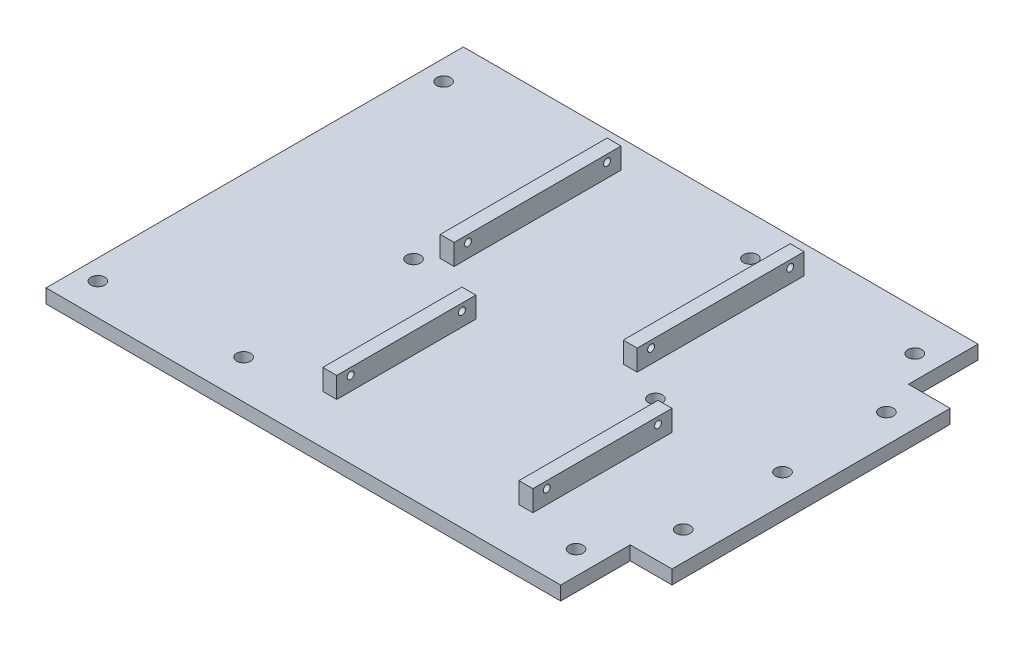
from build123d import *

# Parameters (mm, degrees)
SKETCH1_W               = 508
SKETCH1_H               = 381
BOSS_EXTRUDE1_DEPTH     = 12.7
SKETCH5_W               = 12.7
SKETCH5_H               = 127
BOSS_EXTRUDE2_DEPTH     = 19.05
SKETCH6_W               = 12.7
SKETCH6_H               = 127
BOSS_EXTRUDE3_DEPTH     = 19.05
SKETCH7_W               = 12.7
SKETCH7_H               = 152.4
BOSS_EXTRUDE6_DEPTH     = 19.05
CUT_EXTRUDE1_DEPTH      = 445.227773783
CUT_EXTRUDE1_DEPTH_BACK = 445.227773783
SKETCH8_R               = 3.175
CUT_EXTRUDE2_DEPTH      = 389.026049383
CUT_EXTRUDE2_DEPTH_BACK = 389.026049383
SKETCH9_R               = 3.175
SKETCH10_W              = 38.1
SKETCH10_H              = 63.5
CUT_EXTRUDE3_DEPTH      = 319.070986574
SKETCH11_W              = 38.1
SKETCH11_H              = 63.5
CUT_EXTRUDE4_DEPTH      = 319.070986574
CUT_EXTRUDE5_DEPTH      = 319.070986574
CUT_EXTRUDE5_DEPTH_BACK = 319.070986574
SKETCH13_R              = 6.35


with BuildPart() as part:
    # Sketch1 → Boss-Extrude1 (new body)
    with BuildSketch(Plane(origin=(0, 0, 0), x_dir=(1, 0, 0), z_dir=(0, 1, 0))):
        Rectangle(SKETCH1_W, SKETCH1_H)
    extrude(amount=BOSS_EXTRUDE1_DEPTH)

    # Sketch5 → Boss-Extrude2 (add)
    with BuildSketch(Plane(origin=(0, 12.7, 0), x_dir=(1, 0, 0), z_dir=(0, 1, 0))):
        with Locations((139.7, -82.55)):
            Rectangle(SKETCH5_W, SKETCH5_H)
    extrude(amount=BOSS_EXTRUDE2_DEPTH)

    # Sketch6 → Boss-Extrude3 (add)
    with BuildSketch(Plane(origin=(0, 12.7, 0), x_dir=(1, 0, 0), z_dir=(0, 1, 0))):
        with Locations((-39.37, -82.55)):
            Rectangle(SKETCH6_W, SKETCH6_H)
    extrude(amount=BOSS_EXTRUDE3_DEPTH)

    # Sketch7 → Boss-Extrude6 (add)
    with BuildSketch(Plane(origin=(0, 12.7, 0), x_dir=(1, 0, 0), z_dir=(0, 1, 0))):
        with Locations((76.2, 88.9)):
            Rectangle(SKETCH7_W, SKETCH7_H)
        with Locations((-90.932, 88.9)):
            Rectangle(SKETCH7_W, SKETCH7_H)
    extrude(amount=BOSS_EXTRUDE6_DEPTH)

    # Sketch8 → Cut-Extrude1 (cut, two sides: drawn at the far end of the back side and taken through both)
    with BuildSketch(Plane(origin=(146.05, 0, 0), x_dir=(0, 0, -1), z_dir=(1, 0, 0)).offset(-CUT_EXTRUDE1_DEPTH_BACK)):
        with Locations((-31.75, 25.4)):
            Circle(SKETCH8_R)
        with Locations((-133.35, 25.4)):
            Circle(SKETCH8_R)
    extrude(amount=CUT_EXTRUDE1_DEPTH + CUT_EXTRUDE1_DEPTH_BACK, mode=Mode.SUBTRACT)

    # Sketch9 → Cut-Extrude2 (cut, two sides: drawn at the far end of the back side and taken through both)
    with BuildSketch(Plane(origin=(82.55, 0, 0), x_dir=(0, 0, -1), z_dir=(1, 0, 0)).offset(-CUT_EXTRUDE2_DEPTH_BACK)):
        with Locations((25.4, 25.4)):
            Circle(SKETCH9_R)
        with Locations((152.4, 25.4)):
            Circle(SKETCH9_R)
    extrude(amount=CUT_EXTRUDE2_DEPTH + CUT_EXTRUDE2_DEPTH_BACK, mode=Mode.SUBTRACT)

    # Sketch10 → Cut-Extrude3 (cut, through all)
    with BuildSketch(Plane(origin=(0, 12.7, 0), x_dir=(1, 0, 0), z_dir=(0, 1, 0))):
        with Locations((234.95, -158.75)):
            Rectangle(SKETCH10_W, SKETCH10_H)
    extrude(amount=-CUT_EXTRUDE3_DEPTH, mode=Mode.SUBTRACT)

    # Sketch11 → Cut-Extrude4 (cut, through all)
    with BuildSketch(Plane(origin=(0, 12.7, 0), x_dir=(1, 0, 0), z_dir=(0, 1, 0))):
        with Locations((234.95, 158.75)):
            Rectangle(SKETCH11_W, SKETCH11_H)
    extrude(amount=-CUT_EXTRUDE4_DEPTH, mode=Mode.SUBTRACT)

    # Sketch13 → Cut-Extrude5 (cut, two sides: drawn at the far end of the back side and taken through both)
    with BuildSketch(Plane(origin=(0, 12.7, 0), x_dir=(1, 0, 0), z_dir=(0, 1, 0)).offset(-CUT_EXTRUDE5_DEPTH_BACK)):
        with Locations(Location((227.907081751, 0, 0), (0, 0, 270))):
            Circle(SKETCH13_R)
        with Locations(Location((111.925251719, 0, 0), (0, 0, 270))):
            Circle(SKETCH13_R)
        with Locations(Location((-108.969473195, 0, 0), (0, 0, 270))):
            Circle(SKETCH13_R)
        with Locations(Location((227.907081751, -90.673413336, 0), (0, 0, 270))):
            Circle(SKETCH13_R)
        with Locations(Location((227.907081751, 94.901161445, 0), (0, 0, 270))):
            Circle(SKETCH13_R)
        with Locations(Location((194.548146226, 154.151481102, 0), (0, 0, 270))):
            Circle(SKETCH13_R)
        with Locations(Location((194.548146226, -155.144429721, 0), (0, 0, 270))):
            Circle(SKETCH13_R)
        with Locations(Location((-235.634199607, -161.494429721, 0), (0, 0, 270))):
            Circle(SKETCH13_R)
        with Locations(Location((-235.634199607, 154.151481102, 0), (0, 0, 270))):
            Circle(SKETCH13_R)
        with Locations(Location((44.45, 154.151481102, 0), (0, 0, 270))):
            Circle(SKETCH13_R)
        with Locations(Location((-108.969473196, -155.144429721, 0), (0, 0, 270))):
            Circle(SKETCH13_R)
    extrude(amount=CUT_EXTRUDE5_DEPTH + CUT_EXTRUDE5_DEPTH_BACK, mode=Mode.SUBTRACT)


solid = part.part
